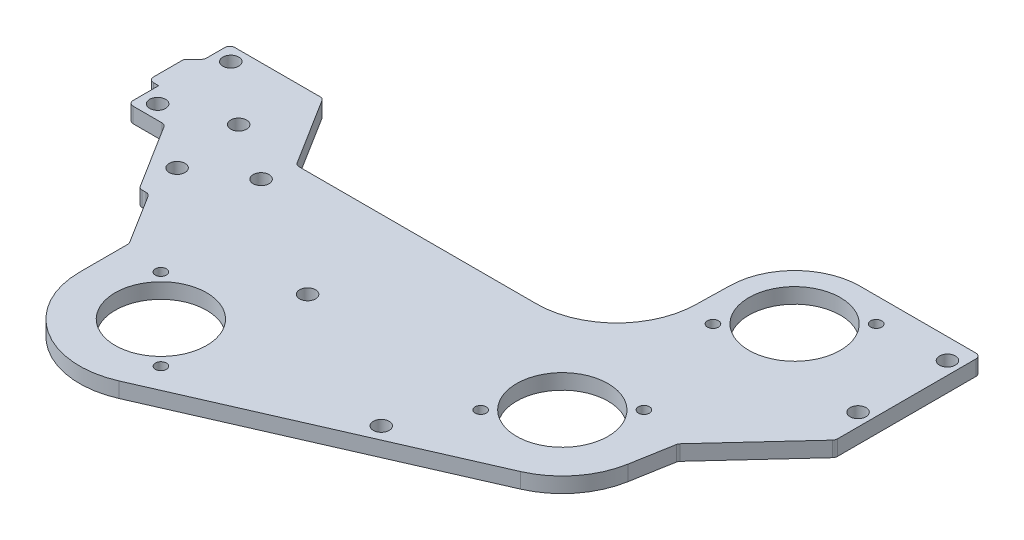
from build123d import *

# Parameters (mm, degrees)
SKETCH1_R                 = 14.29004
BOSS_EXTRUDE1_DEPTH       = 4.7625
F_10_CLEARANCE_HOLE1_D    = 4.9784
F_10_CLEARANCE_HOLE2_D    = 4.9784
TAP_DRILL_FOR_8_32_TAP1_D = 3.4544
F_10_CLEARANCE_HOLE3_D    = 4.9784
FILLET1_R                 = 1.5875


with BuildPart() as part:
    # Sketch1 → Boss-Extrude1 (new body)
    with BuildSketch(Plane(origin=(0, 0, 0), x_dir=(1, 0, 0), z_dir=(0, 1, 0))):
        with BuildLine():
            Line((-62.038222018, -79.883349745), (25.167081601, -41.695780276))
            ThreePointArc((25.167081601, -41.695780276), (34.91524479, -34.148496119), (39.940188099, -22.890693115))
            Line((39.940188099, -22.890693115), (42.275148896, -9.586739751))
            Line((42.275148896, -9.586739751), (65.831008632, 16.012754812))
            Line((65.831008632, 16.012754812), (65.831008632, 61.493591694))
            Line((65.831008632, 61.493591694), (28.046575186, 61.493591694))
            ThreePointArc((28.046575186, 61.493591694), (13.665119108, 55.581463016), (7.599980341, 41.263864189))
            Line((7.599980341, 41.263864189), (7.377499016, 31.276274442))
            ThreePointArc((7.377499016, 31.276274442), (0.022382465, 13.519452313), (-17.734439664, 6.164335762))
            Line((-17.734439664, 6.164335762), (-92.776174625, 6.164335762))
            Line((-92.776174625, 6.164335762), (-106.671272051, 28.401139958))
            Line((-106.671272051, 28.401139958), (-135.754553791, 28.401139958))
            Line((-135.754553791, 28.401139958), (-135.754553791, 20.45773786))
            Line((-135.754553791, 20.45773786), (-138.929553791, 17.28273786))
            Line((-138.929553791, 17.28273786), (-138.929553791, 6.164335762))
            Line((-138.929553791, 6.164335762), (-135.754553791, 6.164335762))
            Line((-135.754553791, 6.164335762), (-135.754553791, -3.360664238))
            Line((-135.754553791, -3.360664238), (-124.263208355, -3.360664238))
            Line((-124.263208355, -3.360664238), (-110.958501432, -24.652646126))
            Line((-110.958501432, -24.652646126), (-107.963388287, -24.652646126))
            Line((-107.963388287, -24.652646126), (-97.659911134, -41.141656383))
            Line((-97.659911134, -41.141656383), (-97.659911134, -56.628468385))
            ThreePointArc((-97.659911134, -56.628468385), (-86.144175153, -77.898718987), (-62.038222018, -79.883349745))
        make_face()
        with Locations(Location((28.046575186, 41.045834415, 0), (0, 0, 90))):
            Circle(SKETCH1_R, mode=Mode.SUBTRACT)
        with Locations(Location((15.031008632, -18.508482198, 0), (0, 0, 90))):
            Circle(SKETCH1_R, mode=Mode.SUBTRACT)
        with Locations(Location((-72.258332946, -56.628468385, 0), (0, 0, 90))):
            Circle(SKETCH1_R, mode=Mode.SUBTRACT)
    extrude(amount=BOSS_EXTRUDE1_DEPTH)

    # #10 Clearance Hole1 (through all)
    with Locations(Plane(origin=(0, 4.7625, 0), x_dir=(1, 0, 0), z_dir=(0, 1, 0))):
        with Locations((61.830508632, 55.024283038), (61.830508632, 27.084283038), (-130.992053791, 23.944335762), (-130.992053791, 1.084335762)):
            Hole(F_10_CLEARANCE_HOLE1_D / 2)

    # #10 Clearance Hole2 (through all)
    with Locations(Plane(origin=(0, 4.7625, 0), x_dir=(1, 0, 0), z_dir=(0, 1, 0))):
        with Locations((-110.620877013, -13.210000682), (-94.465560781, -3.115038698), (-112.732400526, 8.143579493)):
            Hole(F_10_CLEARANCE_HOLE2_D / 2)

    # Tap Drill for #8-32 Tap1 (through all)
    with Locations(Plane(origin=(0, 4.7625, 0), x_dir=(1, 0, 0), z_dir=(0, 1, 0))):
        with Locations((-85.010296638, -43.876504694), (-59.506369254, -69.380432077), (2.27904494, -31.26044589), (27.782972324, -5.756518506), (15.294611495, 28.293870723), (40.798538878, 53.797798107)):
            Hole(TAP_DRILL_FOR_8_32_TAP1_D / 2)

    # #10 Clearance Hole3 (through all)
    with Locations(Plane(origin=(0, 4.7625, 0), x_dir=(1, 0, 0), z_dir=(0, 1, 0))):
        with Locations((-56.041369259, -27.019222928), (-8.951277081, -51.090630662)):
            Hole(F_10_CLEARANCE_HOLE3_D / 2)

    # Fillet1
    fillet1_edges = [part.edges().sort_by_distance(p)[0] for p in [
        (-135.754553791, 2.38125, -20.45773786),
        (-135.754553791, 2.38125, -28.401139958),
        (-106.671272051, 2.38125, -28.401139958),
        (-92.776174625, 2.38125, -6.164335762),
        (65.831008632, 2.38125, -61.493591694),
        (65.831008632, 2.38125, -16.012754812),
        (42.275148896, 2.38125, 9.586739751),
        (-97.659911134, 2.38125, 41.141656383),
        (-107.963388287, 2.38125, 24.652646126),
        (-110.958501432, 2.38125, 24.652646126),
        (-124.263208355, 2.38125, 3.360664238),
        (-135.754553791, 2.38125, 3.360664238),
        (-138.929553791, 2.38125, -6.164335762),
        (-138.929553791, 2.38125, -17.28273786),
    ]]
    fillet(fillet1_edges, radius=FILLET1_R)


solid = part.part
